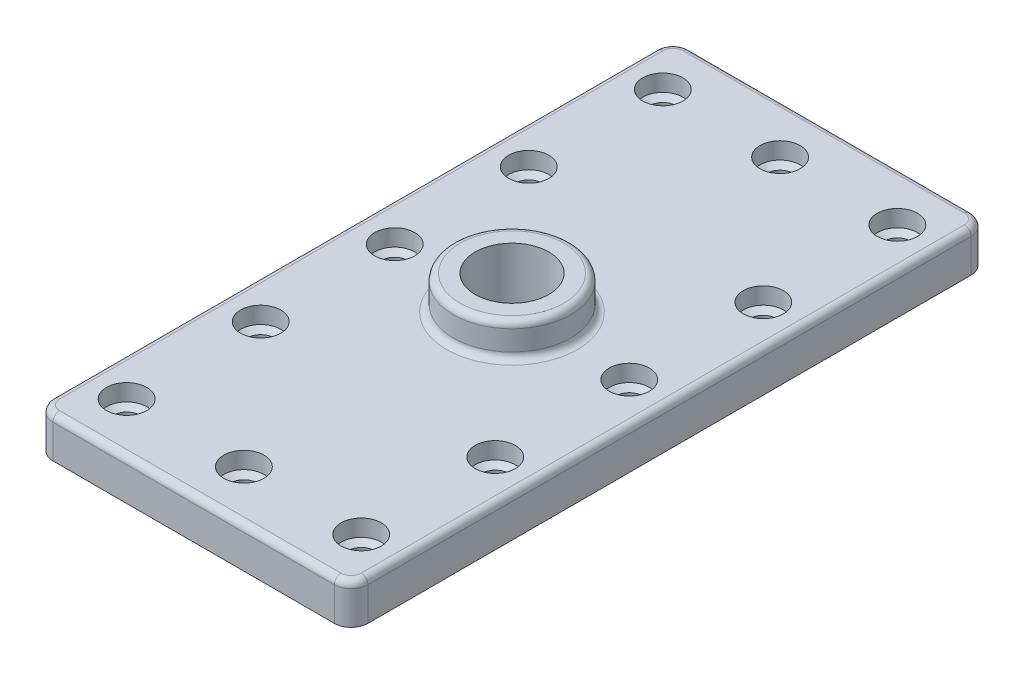
from build123d import *

# Parameters (mm, degrees)
SKETCH1_W            = 94
SKETCH1_H            = 190
PLATE_DEPTH          = 12
SKETCH2_R            = 17.5
BOSS_DEPTH           = 10
SKETCH3_R            = 11
CENTER_HOLE_DEPTH    = 109.249711316
FILLET_R5_R          = 5
FILLET_R2_R          = 2
LPATTERN2_COUNT      = 3
LPATTERN2_PITCH      = 35
LPATTERN2_COUNT_DIR2 = 5
LPATTERN2_PITCH_DIR2 = 40


with BuildPart() as part:
    # Sketch1 → plate (new body)
    with BuildSketch(Plane(origin=(0, 0, 0), x_dir=(1, 0, 0), z_dir=(0, 1, 0))):
        Rectangle(SKETCH1_W, SKETCH1_H)
    extrude(amount=PLATE_DEPTH)

    # Sketch2 → boss (add)
    with BuildSketch(Plane(origin=(0, 12, 0), x_dir=(-1, 0, 0), z_dir=(0, 1, 0))):
        with Locations(Location((0, 0, 0), (0, 0, 270))):
            Circle(SKETCH2_R)
    extrude(amount=BOSS_DEPTH)

    # Sketch3 → center hole (cut, through all)
    with BuildSketch(Plane(origin=(0, 22, 0), x_dir=(-1, 0, 0), z_dir=(0, 1, 0))):
        with Locations(Location((0, 0, 0), (0, 0, 90))):
            Circle(SKETCH3_R)
    extrude(amount=-CENTER_HOLE_DEPTH, mode=Mode.SUBTRACT)

    # Sketch4 → pattern hole (revolve, cut)
    with BuildSketch(Plane(origin=(-35, 12, 80), x_dir=(0, 0, 1), z_dir=(1, 0, 0))):
        Polygon((0, 0), (0, 12), (4, 12), (4, 6.201721238), (6, 5), (6, 0), align=None)
    pattern_hole = revolve(axis=Axis((-35, 18.130023899, 80), (0, -1, 0)), mode=Mode.SUBTRACT)

    # Fillet R5
    fillet_r5_edges = [part.edges().sort_by_distance(p)[0] for p in [
        (-47, 6, -95),
        (47, 6, -95),
        (47, 6, 95),
        (-47, 6, 95),
    ]]
    fillet(fillet_r5_edges, radius=FILLET_R5_R)

    # Fillet R2
    fillet_r2_edges = [part.edges().sort_by_distance(p)[0] for p in [
        (0, 12, 17.5),
        (0, 22, 17.5),
        (47, 12, 0),
        (0, 12, 95),
        (-47, 12, 0),
        (0, 12, -95),
        (45.535533906, 12, -93.535533906),
        (-45.535533906, 12, -93.535533906),
        (-45.535533906, 12, 93.535533906),
        (45.535533906, 12, 93.535533906),
    ]]
    fillet(fillet_r2_edges, radius=FILLET_R2_R)

    # LPattern2: pattern hole 3 × 5, 3 skipped
    with Locations(*[(i * LPATTERN2_PITCH, 0, -j * LPATTERN2_PITCH_DIR2) for i in range(LPATTERN2_COUNT) for j in range(LPATTERN2_COUNT_DIR2) if (i, j) not in ((0, 0), (1, 1), (1, 2), (1, 3))]):
        add(pattern_hole, mode=Mode.SUBTRACT)


solid = part.part
